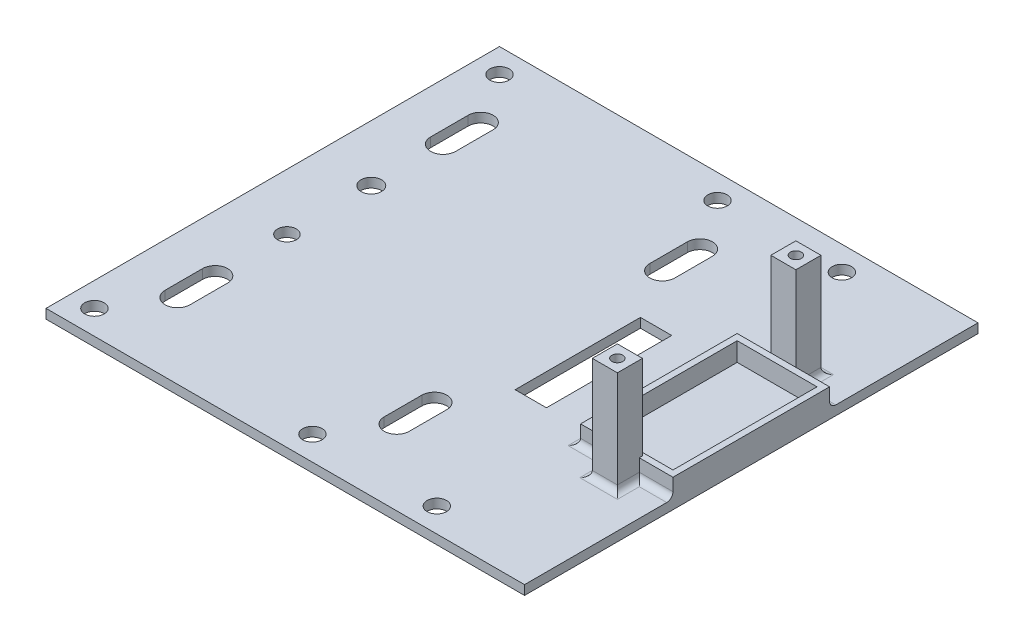
from build123d import *

# Parameters (mm, degrees)
SKETCH1_W           = 62.4
SKETCH1_H           = 72.4
SKETCH1_R           = 1.55
SKETCH1_W_2         = 14
BOSS_EXTRUDE1_DEPTH = 1.5
SKETCH3_W           = 14.75
SKETCH3_H           = 25
SKETCH3_W_2         = 12.75
SKETCH3_H_2         = 23
BOSS_EXTRUDE2_DEPTH = 3
SKETCH4_W           = 4
SKETCH4_H           = 4
BOSS_EXTRUDE3_DEPTH = 16.5
SKETCH5_R           = 0.875
CUT_EXTRUDE1_DEPTH  = 4
FILLET1_R           = 1
SKETCH6_R           = 1.55
CUT_EXTRUDE5_DEPTH  = 61.214034909
SKETCH7_W           = 5
SKETCH7_H           = 20
CUT_EXTRUDE3_DEPTH  = 61.214034909
SKETCH8_R           = 1.5
CUT_EXTRUDE4_DEPTH  = 61.64222951
SKETCH9_R           = 1.636711996
CUT_EXTRUDE6_DEPTH  = 61.214034909


with BuildPart() as part:
    # Sketch1 → Boss-Extrude1 (new body)
    # profile 1 of 2: a face of its own
    with BuildSketch(Plane(origin=(0, 0, 0), x_dir=(1, 0, 0), z_dir=(0, 1, 0))):
        Rectangle(SKETCH1_W, SKETCH1_H)
        with Locations(Location((-27.333, -32.333, 0), (0, 0, 270))):
            Circle(SKETCH1_R, mode=Mode.SUBTRACT)
        with Locations(Location((27.333, -32.333, 0), (0, 0, 270))):
            Circle(SKETCH1_R, mode=Mode.SUBTRACT)
        with Locations(Location((-27.333, 32.333, 0), (0, 0, 270))):
            Circle(SKETCH1_R, mode=Mode.SUBTRACT)
        with Locations(Location((27.333, 32.333, 0), (0, 0, 270))):
            Circle(SKETCH1_R, mode=Mode.SUBTRACT)
    # profile 2 of 2: a face of its own
    with BuildSketch(Plane(origin=(0, 0, 0), x_dir=(1, 0, 0), z_dir=(0, 1, 0))):
        with Locations((38.2, 0)):
            Rectangle(SKETCH1_W_2, SKETCH1_H)
    extrude(amount=BOSS_EXTRUDE1_DEPTH)

    # Sketch3 → Boss-Extrude2 (add)
    with BuildSketch(Plane(origin=(0, 1.5, 0), x_dir=(1, 0, 0), z_dir=(0, 1, 0))):
        with Locations((37.825, 0)):
            Rectangle(SKETCH3_W, SKETCH3_H)
        with Locations((37.825, 0)):
            Rectangle(SKETCH3_W_2, SKETCH3_H_2, mode=Mode.SUBTRACT)
    extrude(amount=BOSS_EXTRUDE2_DEPTH)

    # Sketch4 → Boss-Extrude3 (add)
    with BuildSketch(Plane(origin=(0, 1.5, 0), x_dir=(1, 0, 0), z_dir=(0, 1, 0))):
        with Locations((37.825, -14)):
            Rectangle(SKETCH4_W, SKETCH4_H)
        with Locations((37.825, 14.5)):
            Rectangle(SKETCH4_W, SKETCH4_H)
    extrude(amount=BOSS_EXTRUDE3_DEPTH)

    # Sketch5 → Cut-Extrude1 (cut)
    with BuildSketch(Plane(origin=(0, 18, 0), x_dir=(1, 0, 0), z_dir=(0, 1, 0))):
        with Locations(Location((37.825, -14, 0), (0, 0, 270))):
            Circle(SKETCH5_R)
        with Locations(Location((37.825, 14.5, 0), (0, 0, 270))):
            Circle(SKETCH5_R)
    extrude(amount=-CUT_EXTRUDE1_DEPTH, mode=Mode.SUBTRACT)

    # Fillet1
    fillet1_edges = [part.edges().sort_by_distance(p)[0] for p in [
        (42.5125, 1.5, -12.5),
        (30.45, 1.5, 0),
        (33.1375, 1.5, 12.5),
        (42.5125, 1.5, 12.5),
        (35.825, 1.5, 14.25),
        (39.825, 1.5, 14.25),
        (37.825, 1.5, 16),
        (33.1375, 1.5, -12.5),
        (35.825, 1.5, -14.5),
        (39.825, 1.5, -14.5),
        (37.825, 1.5, -16.5),
    ]]
    fillet(fillet1_edges, radius=FILLET1_R)

    # Sketch6 → Cut-Extrude5 (cut, through all)
    with BuildSketch(Plane(origin=(0, 1.5, 0), x_dir=(1, 0, 0), z_dir=(0, 1, 0))):
        with Locations(Location((7.473, -32.333, 0), (0, 0, 270))):
            Circle(SKETCH6_R)
        with Locations(Location((7.473, 32.333, 0), (0, 0, 270))):
            Circle(SKETCH6_R)
    extrude(amount=-CUT_EXTRUDE5_DEPTH, mode=Mode.SUBTRACT)

    # Sketch7 → Cut-Extrude3 (cut, through all)
    with BuildSketch(Plane(origin=(0, 1.5, 0), x_dir=(1, 0, 0), z_dir=(0, 1, 0))):
        with Locations((20, 0)):
            Rectangle(SKETCH7_W, SKETCH7_H)
    extrude(amount=-CUT_EXTRUDE3_DEPTH, mode=Mode.SUBTRACT)

    # Sketch8 → Cut-Extrude4 (cut, through all)
    with BuildSketch(Plane.XZ):
        with Locations(Location((-22.2, -6.73, 0), (0, 0, 270))):
            Circle(SKETCH8_R)
        with Locations(Location((-22.2, 6.73, 0), (0, 0, 270))):
            Circle(SKETCH8_R)
    extrude(amount=-CUT_EXTRUDE4_DEPTH, mode=Mode.SUBTRACT)

    # Sketch9 → Cut-Extrude6 (cut, through all)
    with BuildSketch(Plane(origin=(0, 1.5, 0), x_dir=(1, 0, 0), z_dir=(0, 1, 0))):
        with Locations(Location((-22.2, 6.73, 0), (0, 0, 270))):
            Circle(SKETCH9_R)
        with BuildLine():
            Line((-20.2, 24.2), (-20.2, 18.2))
            ThreePointArc((-20.2, 18.2), (-22.2, 16.2), (-24.2, 18.2))
            Line((-24.2, 18.2), (-24.2, 24.2))
            ThreePointArc((-24.2, 24.2), (-22.2, 26.2), (-20.2, 24.2))
        make_face()
        with BuildLine():
            Line((-20.2, -18.2), (-20.2, -24.2))
            ThreePointArc((-20.2, -24.2), (-22.2, -26.2), (-24.2, -24.2))
            Line((-24.2, -24.2), (-24.2, -18.2))
            ThreePointArc((-24.2, -18.2), (-22.2, -16.2), (-20.2, -18.2))
        make_face()
        with BuildLine():
            Line((10.8, 24.2), (10.8, 18.2))
            ThreePointArc((10.8, 18.2), (12.8, 16.2), (14.8, 18.2))
            Line((14.8, 18.2), (14.8, 24.2))
            ThreePointArc((14.8, 24.2), (12.8, 26.2), (10.8, 24.2))
        make_face()
        with BuildLine():
            Line((10.8, -18.2), (10.8, -24.2))
            ThreePointArc((10.8, -24.2), (12.8, -26.2), (14.8, -24.2))
            Line((14.8, -24.2), (14.8, -18.2))
            ThreePointArc((14.8, -18.2), (12.8, -16.2), (10.8, -18.2))
        make_face()
    extrude(amount=-CUT_EXTRUDE6_DEPTH, mode=Mode.SUBTRACT)


solid = part.part
